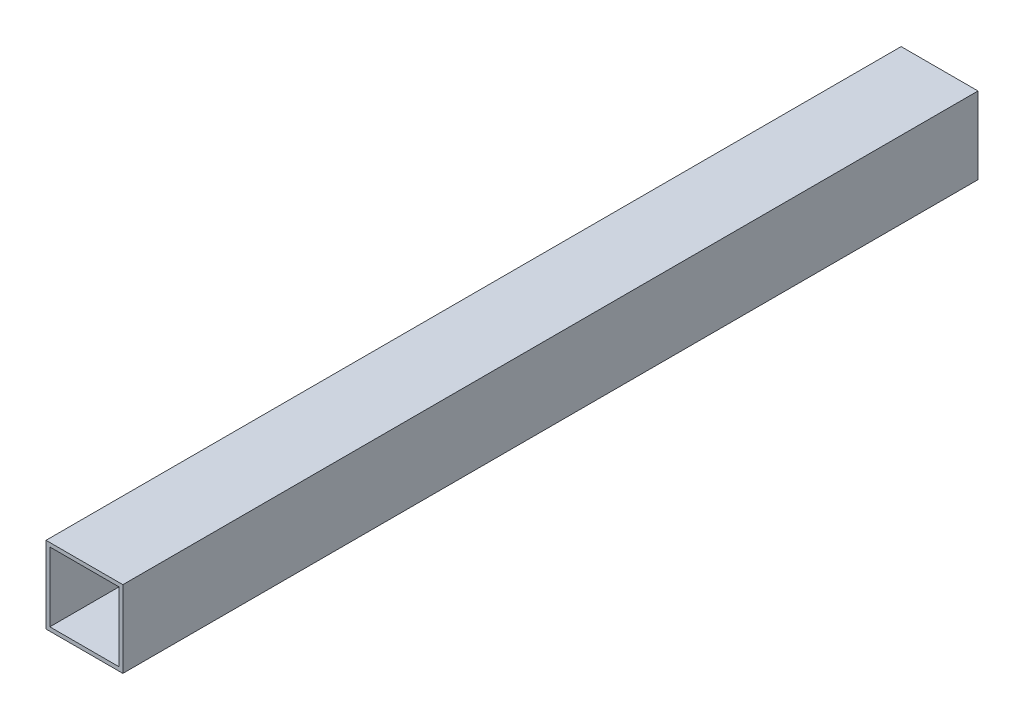
from build123d import *

# Parameters (mm, degrees)
CROQUIS1_W            = 40
CROQUIS1_H            = 40
CROQUIS1_W_2          = 36
CROQUIS1_H_2          = 36
EXTRUIR_L_MINA1_DEPTH = 445


with BuildPart() as part:
    # Croquis1 → Extruir-Lámina1 (new body)
    with BuildSketch(Plane.XY):
        Rectangle(CROQUIS1_W, CROQUIS1_H)
        Rectangle(CROQUIS1_W_2, CROQUIS1_H_2, mode=Mode.SUBTRACT)
    extrude(amount=EXTRUIR_L_MINA1_DEPTH)


solid = part.part
